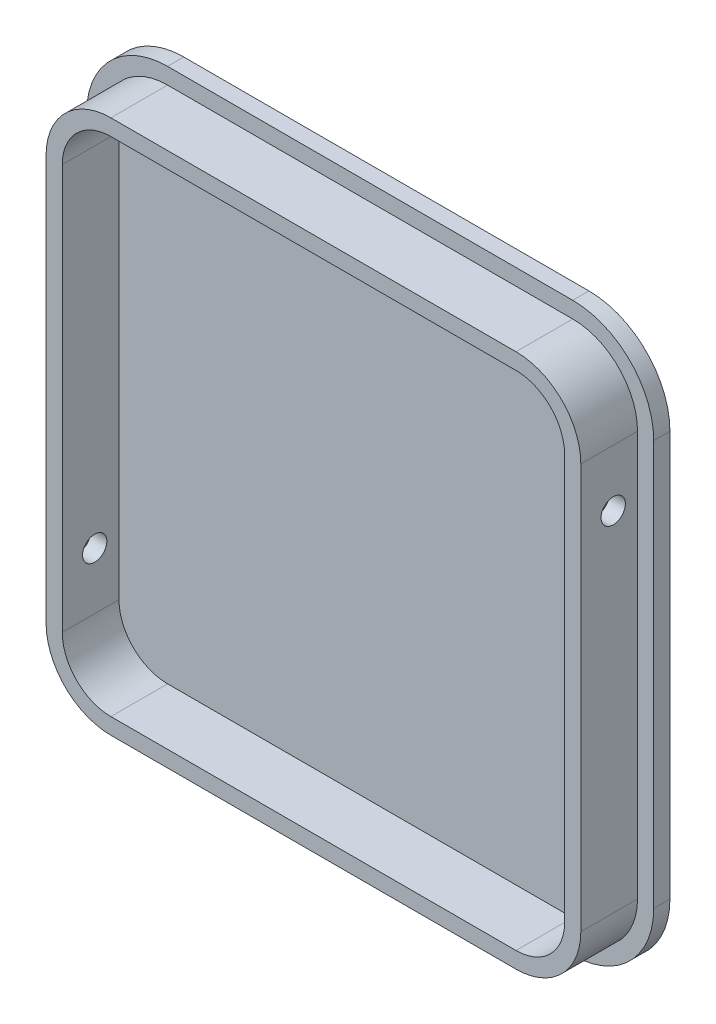
from build123d import *

# Parameters (mm, degrees)
EXTRUDE_1_DEPTH     = 2
EXTRUDE_2_DEPTH     = 7
SHELL_1_T           = -2
SKETCH_3_R          = 1.5
CUT_EXTRUDE_1_DEPTH = 7
SKETCH_4_R          = 1.5
CUT_EXTRUDE_2_DEPTH = 7


with BuildPart() as part:
    # 草图1 → 凸台-拉伸1 (new body)
    with BuildSketch(Plane.XY):
        with BuildLine():
            Line((-23.108505897, 22.918009168), (26.891494103, 22.918009168))
            ThreePointArc((26.891494103, 22.918009168), (33.962561915, 19.989076979), (36.891494103, 12.918009168))
            Line((36.891494103, 12.918009168), (36.891494103, -37.081990832))
            ThreePointArc((36.891494103, -37.081990832), (33.962561915, -44.153058644), (26.891494103, -47.081990832))
            Line((26.891494103, -47.081990832), (-23.108505897, -47.081990832))
            ThreePointArc((-23.108505897, -47.081990832), (-30.179573709, -44.153058644), (-33.108505897, -37.081990832))
            Line((-33.108505897, -37.081990832), (-33.108505897, 12.918009168))
            ThreePointArc((-33.108505897, 12.918009168), (-30.179573709, 19.989076979), (-23.108505897, 22.918009168))
        make_face()
    extrude(amount=EXTRUDE_1_DEPTH)

    # 草图2 → 凸台-拉伸2 (add)
    with BuildSketch(Plane.XY.offset(2)):
        with BuildLine():
            Line((-23.108505897, 20.918009168), (26.891494103, 20.918009168))
            ThreePointArc((26.891494103, 20.918009168), (32.548348353, 18.574863417), (34.891494103, 12.918009168))
            Line((34.891494103, 12.918009168), (34.891494103, -37.081990832))
            ThreePointArc((34.891494103, -37.081990832), (32.548348353, -42.738845082), (26.891494103, -45.081990832))
            Line((26.891494103, -45.081990832), (-23.108505897, -45.081990832))
            ThreePointArc((-23.108505897, -45.081990832), (-28.765360146, -42.738845082), (-31.108505897, -37.081990832))
            Line((-31.108505897, -37.081990832), (-31.108505897, 12.918009168))
            ThreePointArc((-31.108505897, 12.918009168), (-28.765360146, 18.574863417), (-23.108505897, 20.918009168))
        make_face()
    extrude(amount=EXTRUDE_2_DEPTH)

    # 抽壳1
    shell_1_openings = [part.faces().sort_by_distance(p)[0] for p in [
        (1.891494103, -12.081990832, 9),
    ]]
    offset(amount=SHELL_1_T, openings=shell_1_openings, kind=Kind.INTERSECTION)

    # 草图3 → 切除-拉伸1 (cut)
    with BuildSketch(Plane.ZY.offset(31.108505897)):
        with Locations(Location((5, -30.081990832, 0), (0, 0, 270))):
            Circle(SKETCH_3_R)
    extrude(amount=-CUT_EXTRUDE_1_DEPTH, mode=Mode.SUBTRACT)

    # 草图4 → 切除-拉伸2 (cut)
    with BuildSketch(Plane(origin=(34.891494103, 0, 0), x_dir=(0, 0, -1), z_dir=(1, 0, 0))):
        with Locations(Location((-5, 5.918009168, 0), (0, 0, 90))):
            Circle(SKETCH_4_R)
    extrude(amount=-CUT_EXTRUDE_2_DEPTH, mode=Mode.SUBTRACT)


solid = part.part
